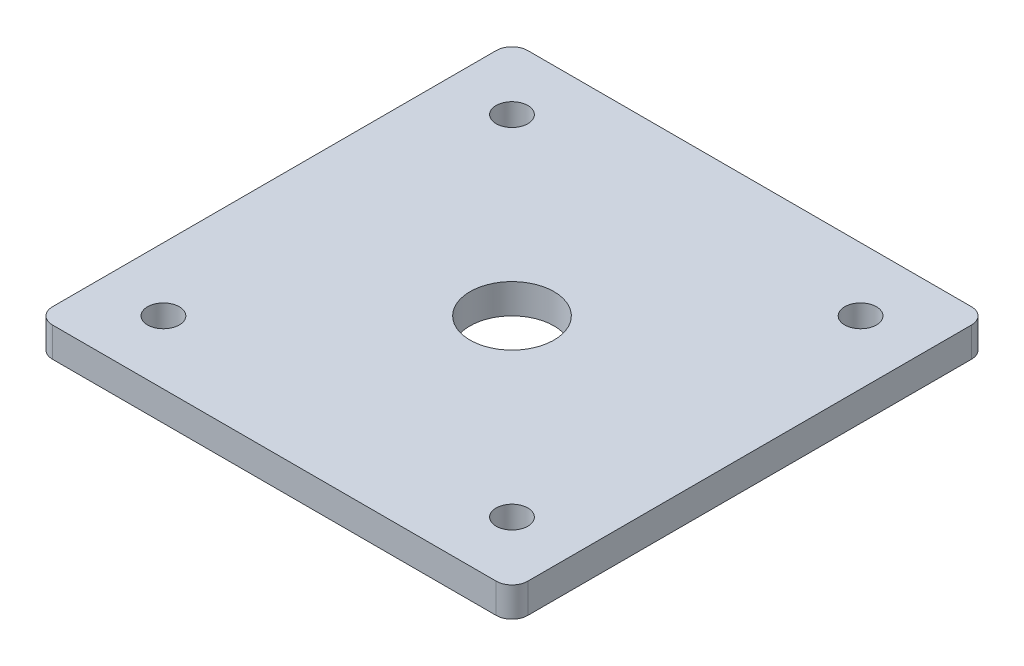
from build123d import *

# Parameters (mm, degrees)
SKETCH2_W           = 38.1
SKETCH2_H           = 38.1
SKETCH2_R           = 1.27
SKETCH2_R_2         = 3.3655
BOSS_EXTRUDE1_DEPTH = 2.38125
FILLET1_R           = 1.27


with BuildPart() as part:
    # Sketch2 → Boss-Extrude1 (new body)
    with BuildSketch(Plane(origin=(0, 0, 0), x_dir=(1, 0, 0), z_dir=(0, 1, 0))):
        Rectangle(SKETCH2_W, SKETCH2_H)
        with Locations(Location((-13.97, 13.97, 0), (0, 0, 90))):
            Circle(SKETCH2_R, mode=Mode.SUBTRACT)
        with Locations(Location((-13.97, -13.97, 0), (0, 0, 90))):
            Circle(SKETCH2_R, mode=Mode.SUBTRACT)
        with Locations(Location((13.97, -13.97, 0), (0, 0, 90))):
            Circle(SKETCH2_R, mode=Mode.SUBTRACT)
        with Locations(Location((13.97, 13.97, 0), (0, 0, 90))):
            Circle(SKETCH2_R, mode=Mode.SUBTRACT)
        with Locations(Location((0, 0, 0), (0, 0, 90))):
            Circle(SKETCH2_R_2, mode=Mode.SUBTRACT)
    extrude(amount=BOSS_EXTRUDE1_DEPTH)

    # Fillet1
    fillet1_edges = [part.edges().sort_by_distance(p)[0] for p in [
        (19.05, 1.190625, 19.05),
        (-19.05, 1.190625, 19.05),
        (-19.05, 1.190625, -19.05),
        (19.05, 1.190625, -19.05),
    ]]
    fillet(fillet1_edges, radius=FILLET1_R)


solid = part.part
